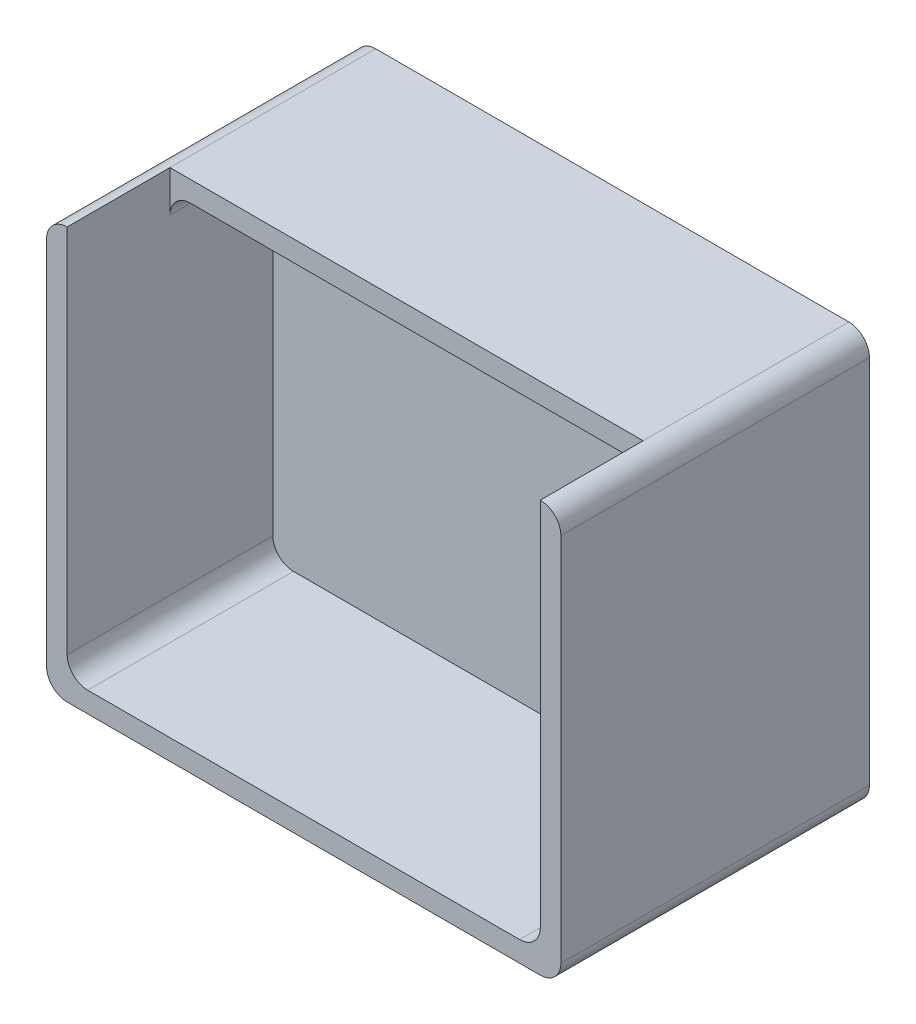
from build123d import *

# Parameters (mm, degrees)
ESBO_O1_W                = 25
ESBO_O1_H                = 20
RESSALTO_EXTRUS_O1_DEPTH = 15
FILETE1_R                = 1
ESBO_O2_W                = 23
ESBO_O2_H                = 18
CORTE_EXTRUS_O1_DEPTH    = 10
FILETE2_R                = 1
CORTE_EXTRUS_O6_START    = -1
ESBO_O6_R                = 4
CORTE_EXTRUS_O6_DEPTH    = 3.5
ESBO_O7_W                = 23
ESBO_O7_H                = 5
CORTE_EXTRUS_O7_DEPTH    = 2


with BuildPart() as part:
    # Esboço1 → Ressalto-extrusão1 (new body)
    with BuildSketch(Plane.XY):
        Rectangle(ESBO_O1_W, ESBO_O1_H)
    extrude(amount=RESSALTO_EXTRUS_O1_DEPTH)

    # Filete1
    filete1_edges = [part.edges().sort_by_distance(p)[0] for p in [
        (-12.5, 10, 7.5),
        (12.5, 10, 7.5),
        (12.5, -10, 7.5),
        (-12.5, -10, 7.5),
    ]]
    fillet(filete1_edges, radius=FILETE1_R)

    # Esboço2 → Corte-extrusão1 (cut)
    with BuildSketch(Plane.XY.offset(15)):
        Rectangle(ESBO_O2_W, ESBO_O2_H)
    extrude(amount=-CORTE_EXTRUS_O1_DEPTH, mode=Mode.SUBTRACT)

    # Filete2
    filete2_edges = [part.edges().sort_by_distance(p)[0] for p in [
        (-11.5, -9, 10),
        (-11.5, 9, 10),
        (11.5, 9, 10),
        (11.5, -9, 10),
    ]]
    fillet(filete2_edges, radius=FILETE2_R)

    # Esboço6 → Corte-extrusão6 (cut)
    with BuildSketch(Plane.XY.offset(CORTE_EXTRUS_O6_START)):
        Circle(ESBO_O6_R)
        with Locations((7.304465977, 5.259215503)):
            Circle(ESBO_O6_R)
        with Locations((7.284465974, -5.310841468)):
            Circle(ESBO_O6_R)
    corte_extrus_o6 = extrude(amount=CORTE_EXTRUS_O6_DEPTH, mode=Mode.SUBTRACT)

    # Espelhar1: Corte-extrusão6 across plane
    add(corte_extrus_o6.mirror(Plane(origin=(0, 0, 0), x_dir=(0, 0, 1), z_dir=(1, 0, 0))), mode=Mode.SUBTRACT)

    # Esboço7 → Corte-extrusão7 (cut)
    with BuildSketch(Plane(origin=(0, 10, 0), x_dir=(1, 0, 0), z_dir=(0, 1, 0))):
        with Locations((0, -12.5)):
            Rectangle(ESBO_O7_W, ESBO_O7_H)
    extrude(amount=-CORTE_EXTRUS_O7_DEPTH, mode=Mode.SUBTRACT)


solid = part.part
